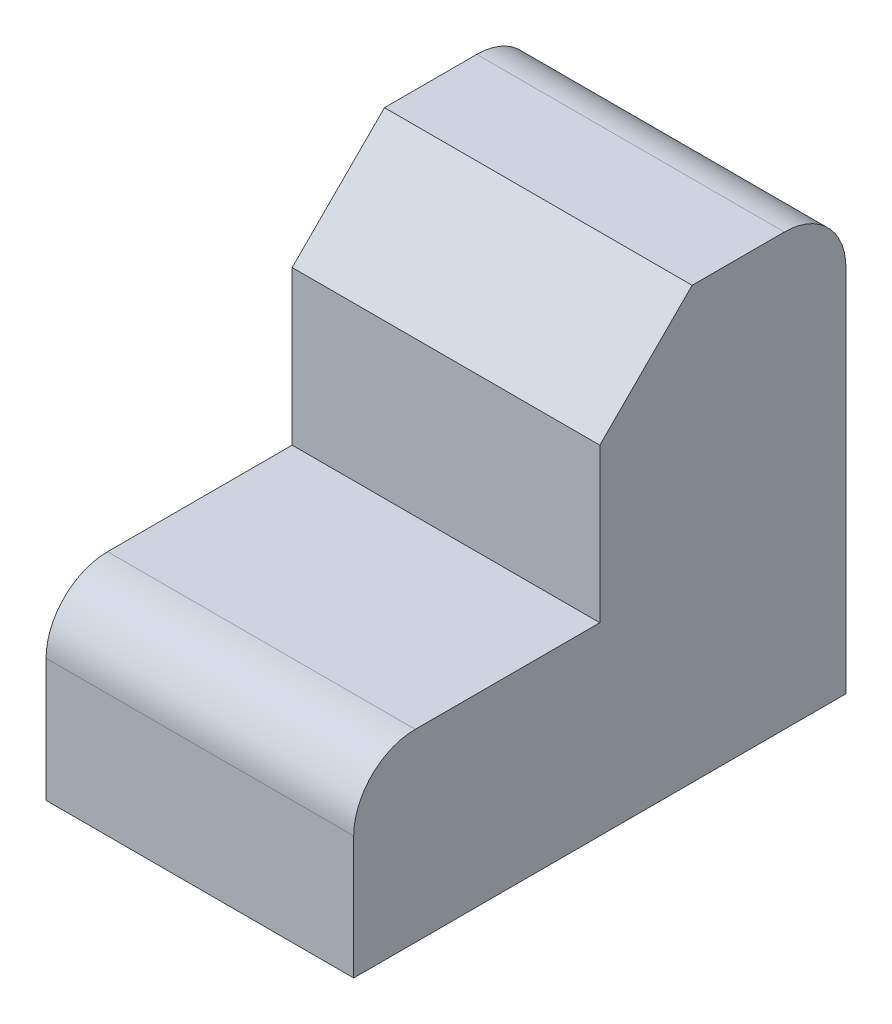
from build123d import *

# Parameters (mm, degrees)
ESBO_O1_W                  = 50
ESBO_O1_H                  = 80
RESSALTO_EXTRUS_O1_DEPTH   = 70
CORTE_EXTRUS_O1_DEPTH      = 118.473401245
CORTE_EXTRUS_O1_DEPTH_BACK = 118.473401245
ESBO_O2_W                  = 40
ESBO_O2_H                  = 40
CHANFRO1_SIZE              = 15
FILETE1_R                  = 10


with BuildPart() as part:
    # Esboço1 → Ressalto-extrusão1 (new body)
    with BuildSketch(Plane(origin=(0, 0, 0), x_dir=(1, 0, 0), z_dir=(0, 1, 0))):
        with Locations((25, 40)):
            Rectangle(ESBO_O1_W, ESBO_O1_H)
    extrude(amount=RESSALTO_EXTRUS_O1_DEPTH)

    # Esboço2 → Corte-extrusão1 (cut, two sides: drawn at the far end of the back side and taken through both)
    with BuildSketch(Plane(origin=(50, 0, 0), x_dir=(0, 0, -1), z_dir=(1, 0, 0)).offset(-CORTE_EXTRUS_O1_DEPTH_BACK)):
        with Locations((20, 50)):
            Rectangle(ESBO_O2_W, ESBO_O2_H)
    extrude(amount=CORTE_EXTRUS_O1_DEPTH + CORTE_EXTRUS_O1_DEPTH_BACK, mode=Mode.SUBTRACT)

    # Chanfro1
    chanfro1_edges = [part.edges().sort_by_distance(p)[0] for p in [
        (25, 70, -40),
    ]]
    chamfer(chanfro1_edges, length=CHANFRO1_SIZE)

    # Filete1
    filete1_edges = [part.edges().sort_by_distance(p)[0] for p in [
        (25, 70, -80),
        (25, 30, 0),
    ]]
    fillet(filete1_edges, radius=FILETE1_R)


solid = part.part
